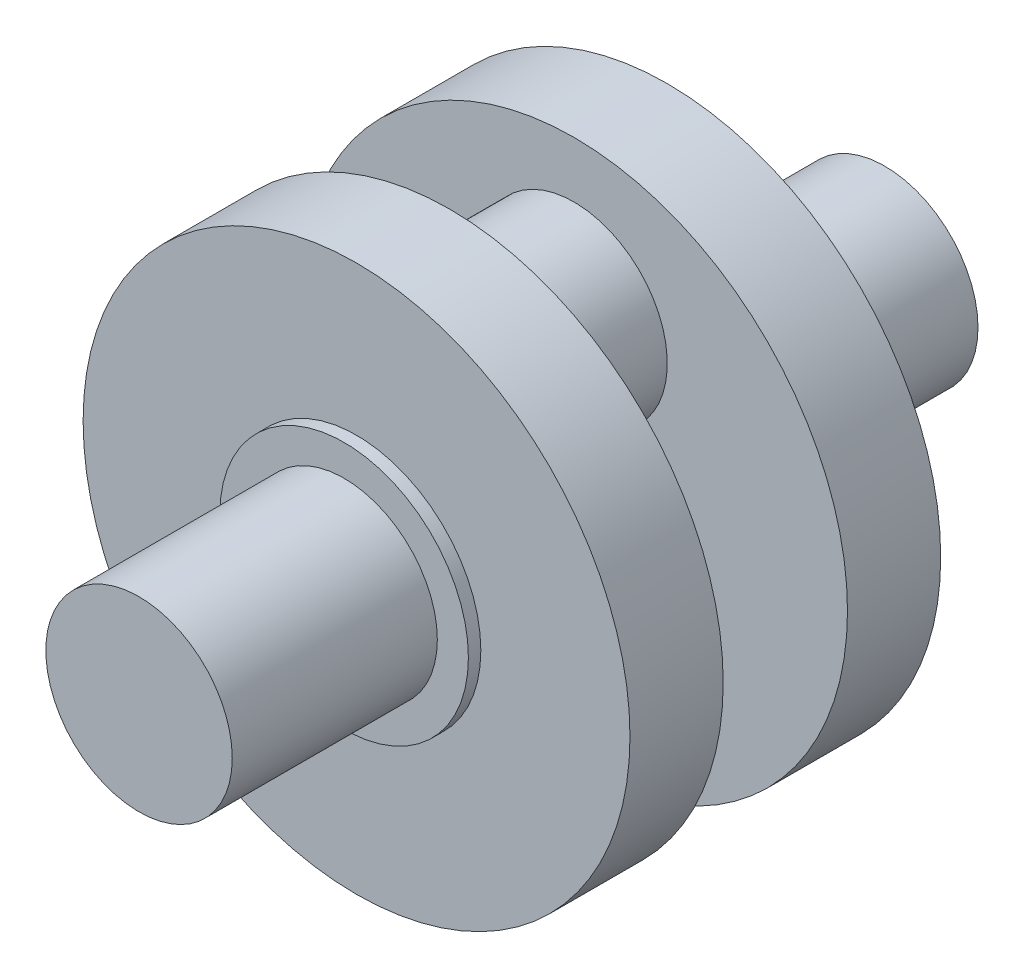
from build123d import *

# Parameters (mm, degrees)
SZKIC2_R                    = 15
DODANIE_WYCI_GNI_CIE1_DEPTH = 33
SZKIC3_R                    = 20
DODANIE_WYCI_GNI_CIE2_DEPTH = 2
SZKIC4_R                    = 44
DODANIE_WYCI_GNI_CIE3_DEPTH = 15
SZKIC5_R                    = 15
DODANIE_WYCI_GNI_CIE4_DEPTH = 10


with BuildPart() as part:
    # Szkic2 → Dodanie-wyciągnięcie1 (new body)
    with BuildSketch(Plane.XY):
        Circle(SZKIC2_R)
    dodanie_wyci_gni_cie1 = extrude(amount=DODANIE_WYCI_GNI_CIE1_DEPTH)

    # Szkic3 → Dodanie-wyciągnięcie2 (add)
    with BuildSketch(Plane(origin=(0, 0, 0), x_dir=(-1, 0, 0), z_dir=(0, 0, -1))):
        Circle(SZKIC3_R)
    dodanie_wyci_gni_cie2 = extrude(amount=DODANIE_WYCI_GNI_CIE2_DEPTH)

    # Szkic4 → Dodanie-wyciągnięcie3 (add)
    with BuildSketch(Plane(origin=(0, 0, -2), x_dir=(-1, 0, 0), z_dir=(0, 0, -1))):
        Circle(SZKIC4_R)
    dodanie_wyci_gni_cie3 = extrude(amount=DODANIE_WYCI_GNI_CIE3_DEPTH)

    # Szkic5 → Dodanie-wyciągnięcie4 (add)
    with BuildSketch(Plane(origin=(0, 0, -17), x_dir=(-1, 0, 0), z_dir=(0, 0, -1))):
        with Locations((0, 20)):
            Circle(SZKIC5_R)
    dodanie_wyci_gni_cie4 = extrude(amount=DODANIE_WYCI_GNI_CIE4_DEPTH)

    # Lustro14: Dodanie-wyciągnięcie1, Dodanie-wyciągnięcie2, Dodanie-wyciągnięcie3, Dodanie-wyciągnięcie4 across plane
    add(dodanie_wyci_gni_cie1.mirror(Plane(origin=(0, 20, -27), x_dir=(1, 0, 0), z_dir=(0, 0, -1))))
    add(dodanie_wyci_gni_cie2.mirror(Plane(origin=(0, 20, -27), x_dir=(1, 0, 0), z_dir=(0, 0, -1))))
    add(dodanie_wyci_gni_cie3.mirror(Plane(origin=(0, 20, -27), x_dir=(1, 0, 0), z_dir=(0, 0, -1))))
    add(dodanie_wyci_gni_cie4.mirror(Plane(origin=(0, 20, -27), x_dir=(1, 0, 0), z_dir=(0, 0, -1))))


solid = part.part
